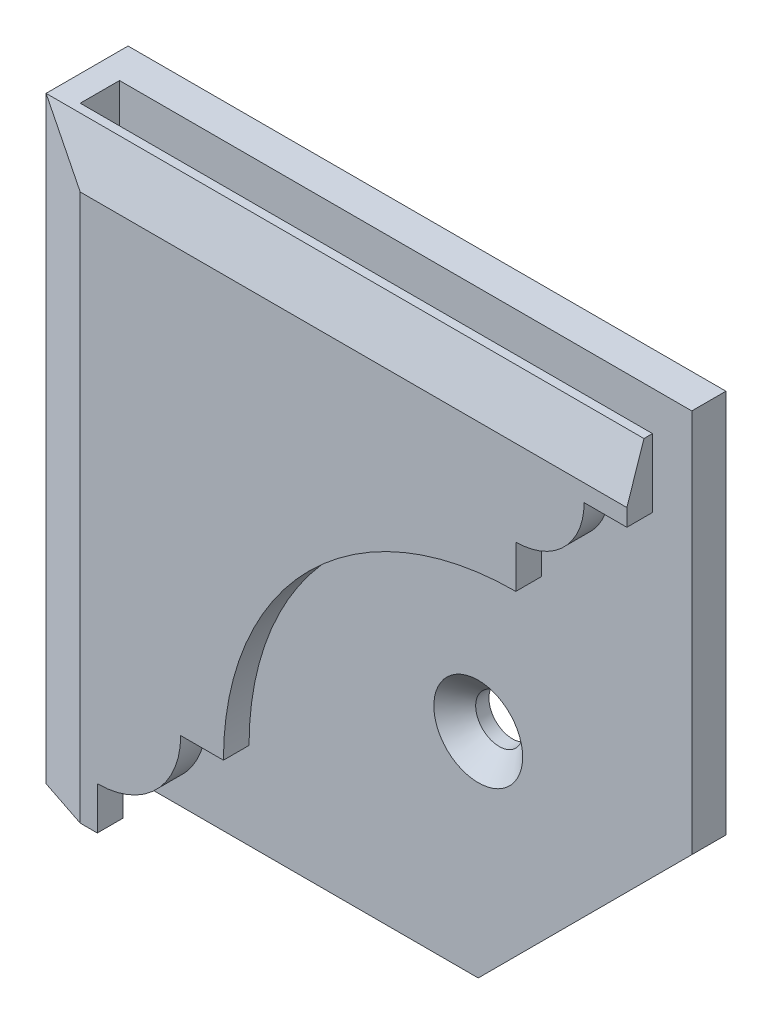
from build123d import *
from OCP.BRepFilletAPI import BRepFilletAPI_MakeChamfer

# Parameters (mm, degrees)
ESQUISSE1_W             = 70
ESQUISSE1_H             = 70
BOSS_EXTRU_1_DEPTH      = 4
BOSS_EXTRU_2_DEPTH      = 4.6
BOSS_EXTRU_3_DEPTH      = 3
CHANFREIN1_SIZE         = 2
CHANFREIN1_SIZE2        = 6
CHANFREIN2_SIZE         = 25
ENL_V_MAT_EXTRU_1_REACH = 78.476
ESQUISSE6_W             = 67
ESQUISSE6_H             = 4.6


with BuildPart() as part:
    # Esquisse1 → Boss.-Extru.1 (new body)
    with BuildSketch(Plane.XY):
        Rectangle(ESQUISSE1_W, ESQUISSE1_H)
    extrude(amount=BOSS_EXTRU_1_DEPTH)

    # Esquisse2 → Boss.-Extru.2 (add)
    with BuildSketch(Plane.XY.offset(4)):
        Polygon((-35, 35), (-35, -35), (-32, -35), (-32, 32), (35, 32), (35, 35), align=None)
    extrude(amount=BOSS_EXTRU_2_DEPTH)

    # Esquisse3 → Boss.-Extru.3 (add)
    with BuildSketch(Plane.XY.offset(8.6)):
        with BuildLine():
            Line((35, 35), (-35, 35))
            Line((-35, 35), (-35, -35))
            Line((-35, -35), (-27, -35))
            Line((-27, -35), (-27, -30))
            ThreePointArc((-27, -30), (-20.095113441, -27.13990234), (-17.235015781, -20.235015781))
            Line((-17.235015781, -20.235015781), (-12.235015781, -20.235015781))
            ThreePointArc((-12.235015781, -20.235015781), (-2.207811813, 3.972796032), (22, 14))
            Line((22, 14), (22, 19))
            ThreePointArc((22, 19), (27.656854249, 21.343145751), (30, 27))
            Line((30, 27), (35, 27))
            Line((35, 27), (35, 35))
        make_face()
    extrude(amount=BOSS_EXTRU_3_DEPTH)

    # Chanfrein1: one chamfer whose edges measure the first distance from different faces: ONE call of the kernel's chamfer builder (chamfer() names one face for all edges)
    chanfrein1_edges_1 = [part.edges().sort_by_distance(p)[0] for p in [
        (0, 35, 11.6),
    ]]
    chanfrein1_side_1 = [part.faces().sort_by_distance(p)[0] for p in [
        (0, 35, 5.8),
    ]]
    chanfrein1_edges_2 = [part.edges().sort_by_distance(p)[0] for p in [
        (-35, 0, 11.6),
    ]]
    chanfrein1_side_2 = [part.faces().sort_by_distance(p)[0] for p in [
        (-35, 0, 5.8),
    ]]
    chanfrein1 = BRepFilletAPI_MakeChamfer(part.part.solid().wrapped)
    for e in chanfrein1_edges_1:
        chanfrein1.Add(CHANFREIN1_SIZE, CHANFREIN1_SIZE2, e.wrapped, chanfrein1_side_1[0].wrapped)  # the first distance lies on this face
    for e in chanfrein1_edges_2:
        chanfrein1.Add(CHANFREIN1_SIZE, CHANFREIN1_SIZE2, e.wrapped, chanfrein1_side_2[0].wrapped)  # the first distance lies on this face
    add(Compound.cast(chanfrein1.Shape()), mode=Mode.REPLACE)

    # Chanfrein2
    chanfrein2_edges = [part.edges().sort_by_distance(p)[0] for p in [
        (35, -35, 2),
    ]]
    chamfer(chanfrein2_edges, length=CHANFREIN2_SIZE)

    # Esquisse4 → Fraisage pour vis à tête fraisée M51 (revolve, cut)
    with BuildSketch(Plane(origin=(10, -10, 4), x_dir=(0, -1, 0), z_dir=(1, 0, 0))):
        Polygon((0, 0), (0, 4), (2.75, 4), (2.75, 2.45), (5.2, 0), align=None)
    revolve(axis=Axis((10, -10, 10.35), (0, 0, -1)), mode=Mode.SUBTRACT)

    # Esquisse6 → Enlèv. mat.-Extru.1 (cut, up to next)
    with BuildSketch(Plane.XZ.offset(-32), mode=Mode.PRIVATE) as enl_v_mat_extru_1_sk1:
        with Locations((1.5, 6.3)):
            Rectangle(ESQUISSE6_W, ESQUISSE6_H)
    enl_v_mat_extru_1_tool1 = extrude(enl_v_mat_extru_1_sk1.sketch, amount=-ENL_V_MAT_EXTRU_1_REACH, mode=Mode.PRIVATE) & part.part
    add(enl_v_mat_extru_1_tool1.solids().sort_by_distance((1.5, 32, 6.3))[0], mode=Mode.SUBTRACT)


solid = part.part
